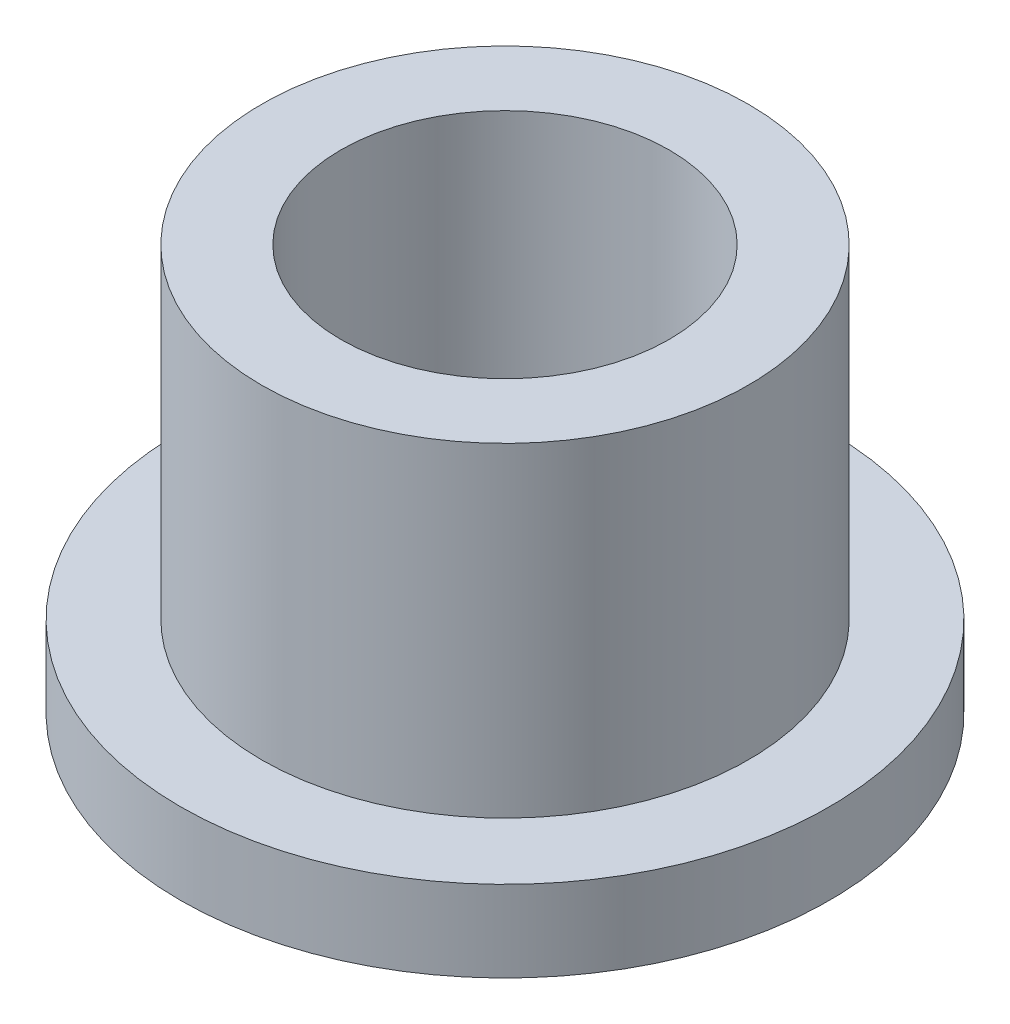
from build123d import *

# Parameters (mm, degrees)
SKETCH2_R           = 4.7625
SKETCH2_R_2         = 3.2131
BOSS_EXTRUDE1_DEPTH = 7.9375
SKETCH3_R           = 6.35
SKETCH3_R_2         = 4.7625
BOSS_EXTRUDE2_DEPTH = 1.5875


with BuildPart() as part:
    # Sketch2 → Boss-Extrude1 (new body)
    with BuildSketch(Plane(origin=(0, 0, 0), x_dir=(1, 0, 0), z_dir=(0, 1, 0))):
        with Locations(Location((0, 0, 0), (0, 0, 270))):
            Circle(SKETCH2_R)
        with Locations(Location((0, 0, 0), (0, 0, 270))):
            Circle(SKETCH2_R_2, mode=Mode.SUBTRACT)
    extrude(amount=BOSS_EXTRUDE1_DEPTH)

    # Sketch3 → Boss-Extrude2 (add)
    with BuildSketch(Plane(origin=(0, 0, 0), x_dir=(1, 0, 0), z_dir=(0, 1, 0))):
        with Locations(Location((0, 0, 0), (0, 0, 270))):
            Circle(SKETCH3_R)
        with Locations(Location((0, 0, 0), (0, 0, 270))):
            Circle(SKETCH3_R_2, mode=Mode.SUBTRACT)
    extrude(amount=BOSS_EXTRUDE2_DEPTH)


solid = part.part
